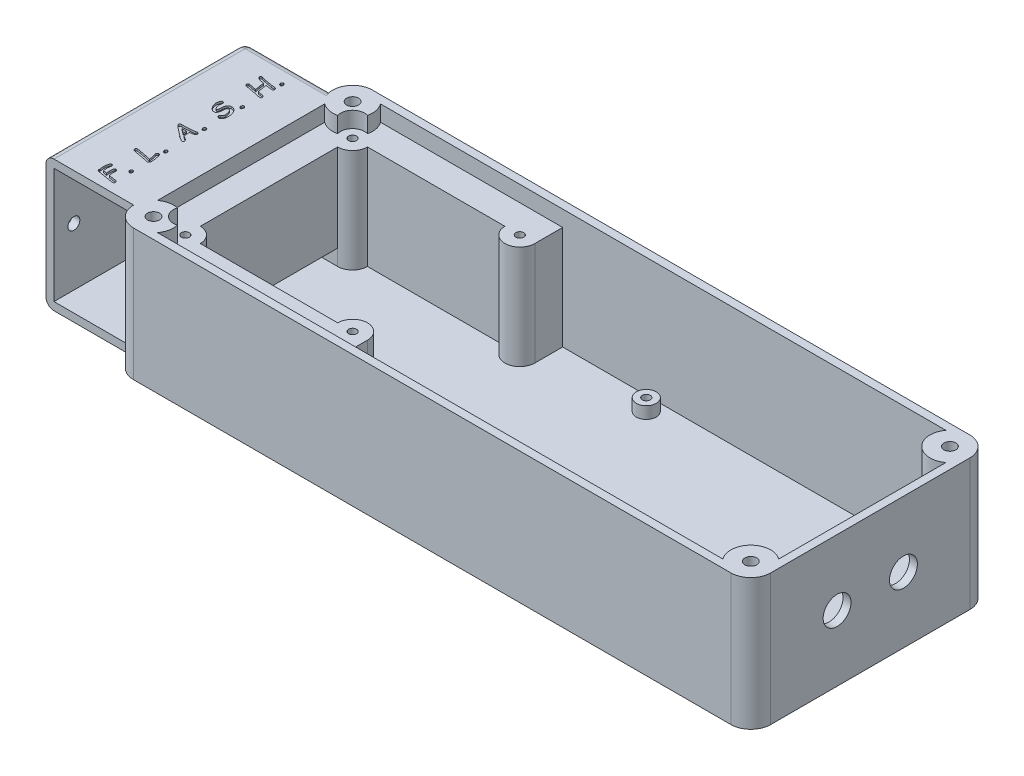
from build123d import *

# Parameters (mm, degrees)
BOSS_EXTRUDE1_DEPTH = 3
BOSS_EXTRUDE2_DEPTH = 30
SKETCH3_R           = 1
BOSS_EXTRUDE3_DEPTH = 26
SKETCH4_R           = 2.5
SKETCH4_R_2         = 1
BOSS_EXTRUDE4_DEPTH = 3
BOSS_EXTRUDE5_DEPTH = 20
SKETCH7_W           = 50
SKETCH7_H           = 33
BOSS_EXTRUDE6_DEPTH = 2
FILLET1_R           = 2
SKETCH8_W           = 34.5
SKETCH8_H           = 4
CUT_EXTRUDE1_DEPTH  = 9
CUT_EXTRUDE2_REACH  = 196.456
SKETCH9_R           = 3.5
SKETCH10_R          = 5
SKETCH10_R_2        = 1.5
BOSS_EXTRUDE7_DEPTH = 30
CUT_EXTRUDE3_DEPTH  = 0.5
CUT_EXTRUDE4_REACH  = 196.456
SKETCH12_R          = 1.5


with BuildPart() as part:
    # Sketch1 → Boss-Extrude1 (new body)
    with BuildSketch(Plane(origin=(0, 0, 0), x_dir=(1, 0, 0), z_dir=(0, 1, 0))):
        with BuildLine():
            Line((5, 0), (155, 0))
            ThreePointArc((155, 0), (158.535533906, -1.464466094), (160, -5))
            Line((160, -5), (160, -55))
            ThreePointArc((160, -55), (158.535533906, -58.535533906), (155, -60))
            Line((155, -60), (5, -60))
            ThreePointArc((5, -60), (1.464466094, -58.535533906), (0, -55))
            Line((0, -55), (0, -5))
            ThreePointArc((0, -5), (1.464466094, -1.464466094), (5, 0))
        make_face()
    extrude(amount=BOSS_EXTRUDE1_DEPTH)

    # Sketch2 → Boss-Extrude2 (add)
    with BuildSketch(Plane(origin=(0, 3, 0), x_dir=(1, 0, 0), z_dir=(0, 1, 0))):
        with BuildLine():
            Line((155, 0), (5, 0))
            ThreePointArc((5, 0), (1.464466094, -1.464466094), (0, -5))
            Line((0, -5), (0, -55))
            ThreePointArc((0, -55), (1.464466094, -58.535533906), (5, -60))
            Line((5, -60), (155, -60))
            ThreePointArc((155, -60), (158.535533906, -58.535533906), (160, -55))
            Line((160, -55), (160, -5))
            ThreePointArc((160, -5), (158.535533906, -1.464466094), (155, 0))
        make_face()
        with BuildLine():
            Line((7, -2), (153, -2))
            ThreePointArc((153, -2), (156.535533906, -3.464466094), (158, -7))
            Line((158, -7), (158, -53))
            ThreePointArc((158, -53), (156.535533906, -56.535533906), (153, -58))
            Line((153, -58), (7, -58))
            ThreePointArc((7, -58), (3.464466094, -56.535533906), (2, -53))
            Line((2, -53), (2, -7))
            ThreePointArc((2, -7), (3.464466094, -3.464466094), (7, -2))
        make_face(mode=Mode.SUBTRACT)
    extrude(amount=BOSS_EXTRUDE2_DEPTH)

    # Sketch3 → Boss-Extrude3 (add)
    with BuildSketch(Plane(origin=(0, 3, 0), x_dir=(1, 0, 0), z_dir=(0, 1, 0))):
        with BuildLine():
            Line((12.75, -9), (47.25, -9))
            ThreePointArc((47.25, -9), (48.348349571, -11.651650429), (51, -12.75))
            ThreePointArc((51, -12.75), (53.651650429, -11.651650429), (54.75, -9))
            Line((54.75, -9), (54.75, -2))
            Line((54.75, -2), (7, -2))
            ThreePointArc((7, -2), (3.464466094, -3.464466094), (2, -7))
            Line((2, -7), (2, -53))
            ThreePointArc((2, -53), (3.464466094, -56.535533906), (7, -58))
            Line((7, -58), (54.75, -58))
            Line((54.75, -58), (54.75, -51))
            ThreePointArc((54.75, -51), (53.651650429, -48.348349571), (51, -47.25))
            ThreePointArc((51, -47.25), (48.348349571, -48.348349571), (47.25, -51))
            Line((47.25, -51), (12.75, -51))
            ThreePointArc((12.75, -51), (11.651650429, -48.348349571), (9, -47.25))
            Line((9, -47.25), (9, -12.75))
            ThreePointArc((9, -12.75), (11.651650429, -11.651650429), (12.75, -9))
        make_face()
        with Locations(Location((9, -9, 0), (0, 0, 270))):
            Circle(SKETCH3_R, mode=Mode.SUBTRACT)
        with Locations(Location((51, -9, 0), (0, 0, 270))):
            Circle(SKETCH3_R, mode=Mode.SUBTRACT)
        with Locations(Location((51, -51, 0), (0, 0, 270))):
            Circle(SKETCH3_R, mode=Mode.SUBTRACT)
        with Locations(Location((9, -51, 0), (0, 0, 270))):
            Circle(SKETCH3_R, mode=Mode.SUBTRACT)
    extrude(amount=BOSS_EXTRUDE3_DEPTH)

    # Sketch4 → Boss-Extrude4 (add)
    # profile 1 of 4: a face of its own
    with BuildSketch(Plane(origin=(0, 3, 0), x_dir=(1, 0, 0), z_dir=(0, 1, 0))):
        with Locations(Location((79.25, -5.5, 0), (0, 0, 90))):
            Circle(SKETCH4_R)
        with Locations(Location((79.25, -5.5, 0), (0, 0, 270))):
            Circle(SKETCH4_R_2, mode=Mode.SUBTRACT)
    # profile 2 of 4: a face of its own
    with BuildSketch(Plane(origin=(0, 3, 0), x_dir=(1, 0, 0), z_dir=(0, 1, 0))):
        with Locations(Location((79.25, -54.5, 0), (0, 0, 90))):
            Circle(SKETCH4_R)
        with Locations(Location((79.25, -54.5, 0), (0, 0, 270))):
            Circle(SKETCH4_R_2, mode=Mode.SUBTRACT)
    # profile 3 of 4: a face of its own
    with BuildSketch(Plane(origin=(0, 3, 0), x_dir=(1, 0, 0), z_dir=(0, 1, 0))):
        with Locations(Location((133.75, -49, 0), (0, 0, 90))):
            Circle(SKETCH4_R)
        with Locations(Location((133.75, -49, 0), (0, 0, 270))):
            Circle(SKETCH4_R_2, mode=Mode.SUBTRACT)
    # profile 4 of 4: a face of its own
    with BuildSketch(Plane(origin=(0, 3, 0), x_dir=(1, 0, 0), z_dir=(0, 1, 0))):
        with Locations(Location((133.75, -21, 0), (0, 0, 90))):
            Circle(SKETCH4_R)
        with Locations(Location((133.75, -21, 0), (0, 0, 270))):
            Circle(SKETCH4_R_2, mode=Mode.SUBTRACT)
    extrude(amount=BOSS_EXTRUDE4_DEPTH)

    # Sketch5 → Boss-Extrude5 (add)
    with BuildSketch(Plane.ZY):
        Polygon((55, 33), (55, 31), (7, 31), (7, 2), (55, 2), (55, 0), (5, 0), (5, 33), align=None)
    extrude(amount=BOSS_EXTRUDE5_DEPTH)

    # Sketch7 → Boss-Extrude6 (add)
    with BuildSketch(Plane.ZY.offset(20)):
        with Locations((30, 16.5)):
            Rectangle(SKETCH7_W, SKETCH7_H)
    extrude(amount=BOSS_EXTRUDE6_DEPTH)

    # Fillet1
    fillet1_edges = [part.edges().sort_by_distance(p)[0] for p in [
        (-11, 33, 5),
        (-11, 0, 5),
        (-22, 16.5, 5),
        (-22, 0, 30),
        (-22, 33, 30),
    ]]
    fillet(fillet1_edges, radius=FILLET1_R)

    # Sketch8 → Cut-Extrude1 (cut)
    with BuildSketch(Plane(origin=(9, 0, 0), x_dir=(0, 0, -1), z_dir=(1, 0, 0))):
        with Locations((-30, 5)):
            Rectangle(SKETCH8_W, SKETCH8_H)
    extrude(amount=-CUT_EXTRUDE1_DEPTH, mode=Mode.SUBTRACT)

    # Sketch9 → Cut-Extrude2 (cut, up to next)
    with BuildSketch(Plane(origin=(160, 0, 0), x_dir=(0, 0, -1), z_dir=(1, 0, 0)), mode=Mode.PRIVATE) as cut_extrude2_sk1:
        with Locations((-21.666666667, 16.5)):
            Circle(SKETCH9_R)
    cut_extrude2_tool1 = extrude(cut_extrude2_sk1.sketch, amount=-CUT_EXTRUDE2_REACH, mode=Mode.PRIVATE) & part.part
    # Sketch9 → Cut-Extrude2 (cut, up to next)
    with BuildSketch(Plane(origin=(160, 0, 0), x_dir=(0, 0, -1), z_dir=(1, 0, 0)), mode=Mode.PRIVATE) as cut_extrude2_sk2:
        with Locations((-38.333333333, 16.5)):
            Circle(SKETCH9_R)
    cut_extrude2_tool2 = extrude(cut_extrude2_sk2.sketch, amount=-CUT_EXTRUDE2_REACH, mode=Mode.PRIVATE) & part.part
    add(cut_extrude2_tool1.solids().sort_by_distance((160, 16.5, 21.666667))[0], mode=Mode.SUBTRACT)
    add(cut_extrude2_tool2.solids().sort_by_distance((160, 16.5, 38.333333))[0], mode=Mode.SUBTRACT)

    # Sketch10 → Boss-Extrude7 (add)
    # profile 1 of 4: a face of its own
    with BuildSketch(Plane(origin=(0, 3, 0), x_dir=(1, 0, 0), z_dir=(0, 1, 0))):
        with Locations((155, -5)):
            Circle(SKETCH10_R)
        with Locations(Location((155, -5, 0), (0, 0, 270))):
            Circle(SKETCH10_R_2, mode=Mode.SUBTRACT)
    # profile 2 of 4: a face of its own
    with BuildSketch(Plane(origin=(0, 3, 0), x_dir=(1, 0, 0), z_dir=(0, 1, 0))):
        with Locations((155, -55)):
            Circle(SKETCH10_R)
        with Locations(Location((155, -55, 0), (0, 0, 270))):
            Circle(SKETCH10_R_2, mode=Mode.SUBTRACT)
    # profile 3 of 4: a face of its own
    with BuildSketch(Plane(origin=(0, 3, 0), x_dir=(1, 0, 0), z_dir=(0, 1, 0))):
        with BuildLine():
            ThreePointArc((9.870828693, -6.129171307), (1.464466094, -1.464466094), (6.129171307, -9.870828693))
            ThreePointArc((6.129171307, -9.870828693), (6.878679656, -6.878679656), (9.870828693, -6.129171307))
        make_face()
        with Locations(Location((5, -5, 0), (0, 0, 270))):
            Circle(SKETCH10_R_2, mode=Mode.SUBTRACT)
    # profile 4 of 4: a face of its own
    with BuildSketch(Plane(origin=(0, 3, 0), x_dir=(1, 0, 0), z_dir=(0, 1, 0))):
        with BuildLine():
            ThreePointArc((6.129171307, -50.129171307), (1.464466094, -58.535533906), (9.870828693, -53.870828693))
            ThreePointArc((9.870828693, -53.870828693), (6.878679656, -53.121320344), (6.129171307, -50.129171307))
        make_face()
        with Locations(Location((5, -55, 0), (0, 0, 270))):
            Circle(SKETCH10_R_2, mode=Mode.SUBTRACT)
    extrude(amount=BOSS_EXTRUDE7_DEPTH)

    # Sketch11 → Cut-Extrude3 (cut)
    # profile 1 of 10: a face of its own
    with BuildSketch(Plane(origin=(0, 33, 0), x_dir=(1, 0, 0), z_dir=(0, 1, 0))):
        with BuildLine():
            add(Edge.make_bspline(
                [(-7.572070313, -10.621972656), (-7.600806562, -10.619995989), (-7.658970131, -10.615995119), (-7.742585597, -10.580677182), (-7.821140659, -10.525528326), (-7.892194562, -10.451150341), (-7.95363411, -10.365017402), (-7.998031542, -10.269917838), (-8.027063241, -10.17045346), (-8.030174539, -10.101858655), (-8.031738281, -10.067382813)],
                knots=[0, 0, 0, 0, 0.870726891, 1.76239366, 2.716285421, 3.774654455, 4.87450341, 5.918603683, 6.95388735, 8, 8, 8, 8], degree=3))
            add(Edge.make_bspline(
                [(-8.031738281, -10.067382813), (-8.030777497, -10.036787302), (-8.028935831, -9.978140712), (-8.008805107, -9.894968702), (-7.977642726, -9.82083708), (-7.932948832, -9.7579503), (-7.879941561, -9.706859631), (-7.819405358, -9.669734183), (-7.752734035, -9.646386999), (-7.705855585, -9.644059045), (-7.681933594, -9.642871094)],
                knots=[0, 0, 0, 0, 1.192390478, 2.285617512, 3.320552277, 4.313938436, 5.276821529, 6.175379738, 7.068899467, 8, 8, 8, 8], degree=3))
            add(Edge.make_bspline(
                [(-7.681933594, -9.642871094), (-7.651755013, -9.644837385), (-7.59172435, -9.648748695), (-7.505353903, -9.682830508), (-7.425963891, -9.737986576), (-7.355996363, -9.812833103), (-7.294559155, -9.89839364), (-7.251375911, -9.994424337), (-7.223569614, -10.095707147), (-7.22036789, -10.165638814), (-7.21875, -10.200976563)],
                knots=[0, 0, 0, 0, 0.904529017, 1.799272064, 2.749551301, 3.789732453, 4.86478719, 5.901270539, 6.939473697, 8, 8, 8, 8], degree=3))
            add(Edge.make_bspline(
                [(-7.21875, -10.200976563), (-7.220187759, -10.229197872), (-7.222979334, -10.283992777), (-7.242283905, -10.363511708), (-7.277775481, -10.435254108), (-7.323490176, -10.499759684), (-7.378266761, -10.552804263), (-7.438138916, -10.593386538), (-7.503869497, -10.617189974), (-7.549333554, -10.620378208), (-7.572070313, -10.621972656)],
                knots=[0, 0, 0, 0, 1.115563064, 2.165993459, 3.207062572, 4.261125149, 5.276633054, 6.204865414, 7.102245947, 8, 8, 8, 8], degree=3))
        make_face()
    # profile 2 of 10: a face of its own
    with BuildSketch(Plane(origin=(0, 33, 0), x_dir=(1, 0, 0), z_dir=(0, 1, 0))):
        with BuildLine():
            add(Edge.make_bspline(
                [(-9.365917969, -12.330566406), (-9.364497364, -12.354592007), (-9.361464023, -12.405892575), (-9.355635781, -12.488021252), (-9.345338849, -12.579910532), (-9.333882646, -12.682147913), (-9.32128235, -12.794510025), (-9.303721006, -12.916492134), (-9.286134221, -13.048541654), (-9.262913741, -13.190021612), (-9.241203192, -13.342384059), (-9.214045166, -13.504181351), (-9.186529761, -13.676353846), (-9.154202456, -13.858073122), (-9.121087673, -14.050015268), (-9.086100145, -14.252299457), (-9.04715415, -14.46396268), (-9.020779389, -14.608687629), (-9.007324219, -14.682519531)],
                knots=[0, 0, 0, 0, 0.485350309, 1.036342316, 1.660070137, 2.349680616, 3.111070915, 3.939909977, 4.834742519, 5.797318768, 6.830869476, 7.938114566, 9.105570656, 10.346869518, 11.660039808, 13.033440574, 14.486600069, 16, 16, 16, 16], degree=3))
            add(Edge.make_bspline(
                [(-9.007324219, -14.682519531), (-8.985928745, -14.686280467), (-8.941047086, -14.694169848), (-8.870485822, -14.707596932), (-8.793298166, -14.722161414), (-8.709930327, -14.740096283), (-8.61999239, -14.759444057), (-8.523601059, -14.780517983), (-8.420645624, -14.803128902), (-8.35017195, -14.819819664), (-8.313867188, -14.828417969)],
                knots=[0, 0, 0, 0, 0.735613483, 1.54310925, 2.432282106, 3.39541894, 4.430612042, 5.547574119, 6.736624149, 8, 8, 8, 8], degree=3))
            add(Edge.make_bspline(
                [(-8.313867188, -14.828417969), (-8.27490487, -14.836633905), (-8.199903505, -14.852449351), (-8.091745845, -14.87504259), (-7.99243622, -14.897032659), (-7.900663923, -14.913662376), (-7.817973606, -14.930897514), (-7.743456136, -14.944717136), (-7.67766616, -14.957457414), (-7.636246929, -14.964155565), (-7.616894531, -14.967285156)],
                knots=[0, 0, 0, 0, 1.34460385, 2.588324615, 3.731163278, 4.778881834, 5.737323996, 6.58327211, 7.338059151, 8, 8, 8, 8], degree=3))
            add(Edge.make_bspline(
                [(-7.616894531, -14.967285156), (-7.589363965, -14.97271178), (-7.535391455, -14.983350447), (-7.459096138, -15.017040245), (-7.391287296, -15.066422416), (-7.331304439, -15.127546212), (-7.281681468, -15.196950945), (-7.244751409, -15.27155799), (-7.222830047, -15.350134304), (-7.220110696, -15.403677214), (-7.21875, -15.43046875)],
                knots=[0, 0, 0, 0, 1.013249324, 1.986432401, 2.989703123, 4.031830092, 5.073309642, 6.064348679, 7.031448397, 8, 8, 8, 8], degree=3))
            add(Edge.make_bspline(
                [(-7.21875, -15.43046875), (-7.21980675, -15.454635791), (-7.221851218, -15.501391142), (-7.241215534, -15.567583644), (-7.271200018, -15.627530857), (-7.314755944, -15.677690141), (-7.365575143, -15.719227027), (-7.422973959, -15.750084797), (-7.486648923, -15.767930228), (-7.530944456, -15.770281223), (-7.553613281, -15.771484375)],
                knots=[0, 0, 0, 0, 1.083594083, 2.096401497, 3.073932841, 4.07364677, 5.056572285, 6.010770162, 6.981985316, 8, 8, 8, 8], degree=3))
            add(Edge.make_bspline(
                [(-7.553613281, -15.771484375), (-7.568581653, -15.770873368), (-7.60575944, -15.769355776), (-7.671758691, -15.757703589), (-7.759611222, -15.743777053), (-7.86857683, -15.720556046), (-7.999675308, -15.69376438), (-8.152417542, -15.660456544), (-8.326450045, -15.619369545), (-8.449795746, -15.590684078), (-8.515136719, -15.575488281)],
                knots=[0, 0, 0, 0, 0.365775055, 0.908496073, 1.634736488, 2.540401088, 3.63003813, 4.905185618, 6.360557522, 8, 8, 8, 8], degree=3))
            add(Edge.make_bspline(
                [(-8.515136719, -15.575488281), (-8.547364453, -15.567878314), (-8.616179152, -15.55162903), (-8.72634935, -15.525450222), (-8.850920496, -15.50009069), (-8.989014887, -15.470491969), (-9.140853649, -15.440104757), (-9.306607682, -15.407234425), (-9.48638217, -15.373624944), (-9.679769589, -15.335881032), (-9.887186815, -15.299055366), (-10.108088552, -15.257607353), (-10.343332773, -15.217294259), (-10.592203826, -15.172780344), (-10.854740521, -15.127279045), (-11.131372421, -15.079930489), (-11.421542595, -15.029466657), (-11.619997961, -14.9964551), (-11.721386719, -14.979589844)],
                knots=[0, 0, 0, 0, 0.487332004, 1.04058215, 1.666327894, 2.358023282, 3.119022813, 3.945131937, 4.844840007, 5.810498492, 6.844762184, 7.944969867, 9.1180837, 10.357132996, 11.66561901, 13.039300903, 14.487409998, 16, 16, 16, 16], degree=3))
            add(Edge.make_bspline(
                [(-11.721386719, -14.979589844), (-11.74836198, -14.974523456), (-11.801585172, -14.964527286), (-11.876040495, -14.930444984), (-11.943502692, -14.883272089), (-12.002711468, -14.823577061), (-12.051813863, -14.755241526), (-12.086453587, -14.679640729), (-12.108653283, -14.599696017), (-12.111207862, -14.54438385), (-12.1125, -14.51640625)],
                knots=[0, 0, 0, 0, 0.994830868, 1.962838208, 2.949825045, 3.974214553, 5.005723903, 5.992250767, 6.984454788, 8, 8, 8, 8], degree=3))
            add(Edge.make_bspline(
                [(-12.1125, -14.51640625), (-12.111223989, -14.492591263), (-12.108748896, -14.446397081), (-12.092278583, -14.379988606), (-12.062199633, -14.32102055), (-12.022653017, -14.268856442), (-11.974009797, -14.225571935), (-11.91688285, -14.195383238), (-11.85418376, -14.175912592), (-11.810012347, -14.173826385), (-11.787304688, -14.172753906)],
                knots=[0, 0, 0, 0, 1.080254188, 2.095380478, 3.075827588, 4.061751347, 5.050446695, 6.0016474, 6.972686053, 8, 8, 8, 8], degree=3))
            add(Edge.make_bspline(
                [(-11.787304688, -14.172753906), (-11.775573015, -14.173178302), (-11.746728354, -14.174221764), (-11.695475951, -14.181339197), (-11.62779313, -14.191820704), (-11.543808564, -14.207127618), (-11.443233532, -14.225403295), (-11.326372259, -14.24846749), (-11.193043639, -14.275592644), (-11.098810454, -14.295715812), (-11.049023438, -14.306347656)],
                knots=[0, 0, 0, 0, 0.37507502, 0.922196926, 1.652020016, 2.565064674, 3.650657883, 4.919803416, 6.372613655, 8, 8, 8, 8], degree=3))
            Line((-11.049023438, -14.306347656), (-10.658789063, -14.377539063))
            add(Edge.make_bspline(
                [(-10.658789063, -14.377539063), (-10.602220879, -14.387360774), (-10.495435935, -14.405901424), (-10.344593996, -14.434265585), (-10.212071649, -14.460205822), (-10.12995306, -14.478188991), (-10.091894531, -14.486523438)],
                knots=[0, 0, 0, 0, 1.193363047, 2.252736389, 3.190216443, 4, 4, 4, 4], degree=3))
            add(Edge.make_bspline(
                [(-10.091894531, -14.486523438), (-10.039901615, -14.500394404), (-9.940257716, -14.52697797), (-9.838900162, -14.545987517), (-9.790429688, -14.555078125)],
                knots=[0, 0, 0, 0, 1.04357451, 2, 2, 2, 2], degree=3))
            Line((-9.790429688, -14.555078125), (-10.01015625, -13.374707031))
            add(Edge.make_bspline(
                [(-10.01015625, -13.374707031), (-10.027500575, -13.274907675), (-10.061801823, -13.077538077), (-10.1014535, -12.782985666), (-10.128926855, -12.49385207), (-10.138848949, -12.30277941), (-10.14375, -12.208398438)],
                knots=[0, 0, 0, 0, 1.034536652, 2.045965941, 3.034798409, 4, 4, 4, 4], degree=3))
            add(Edge.make_bspline(
                [(-10.14375, -12.208398438), (-10.16394024, -12.203598742), (-10.210908397, -12.192433307), (-10.292329119, -12.176371829), (-10.393970523, -12.155205832), (-10.516206391, -12.129186645), (-10.659732834, -12.101790066), (-10.82366612, -12.068912611), (-11.008266817, -12.033027032), (-11.138082586, -12.007990145), (-11.206347656, -11.994824219)],
                knots=[0, 0, 0, 0, 0.459481678, 1.06888316, 1.837316034, 2.758429123, 3.835999413, 5.072592057, 6.460589882, 8, 8, 8, 8], degree=3))
            add(Edge.make_bspline(
                [(-11.206347656, -11.994824219), (-11.251486827, -11.985424412), (-11.345330678, -11.965882313), (-11.486439514, -11.911778556), (-11.632548632, -11.837001008), (-11.755946145, -11.761950488), (-11.849526684, -11.692634328), (-11.913733903, -11.642591988), (-11.966426203, -11.590868509), (-12.01111554, -11.541477647), (-12.04504446, -11.491308775), (-12.070167259, -11.44258196), (-12.085185935, -11.393631891), (-12.087589394, -11.361224868), (-12.088769531, -11.3453125)],
                knots=[0, 0, 0, 0, 1.438266724, 2.990141036, 4.700705817, 6.562071707, 7.491832014, 8.337849346, 9.101467746, 9.795281904, 10.414551478, 10.987466272, 11.502829696, 12, 12, 12, 12], degree=3))
            add(Edge.make_bspline(
                [(-12.088769531, -11.3453125), (-12.087596453, -11.321462452), (-12.085303408, -11.274842192), (-12.067003748, -11.20781526), (-12.037745495, -11.145790674), (-11.996257669, -11.091145192), (-11.947459994, -11.044580925), (-11.891167722, -11.011334646), (-11.830463195, -10.989649578), (-11.787780364, -10.987702626), (-11.766210938, -10.98671875)],
                knots=[0, 0, 0, 0, 1.0677216, 2.087100932, 3.091566911, 4.123808257, 5.145975439, 6.094178081, 7.036908172, 8, 8, 8, 8], degree=3))
            add(Edge.make_bspline(
                [(-11.766210938, -10.98671875), (-11.74043834, -10.988025778), (-11.688295348, -10.99067015), (-11.639643748, -11.009643066), (-11.615039063, -11.019238281)],
                knots=[0, 0, 0, 0, 0.988535437, 2, 2, 2, 2], degree=3))
            add(Edge.make_bspline(
                [(-11.615039063, -11.019238281), (-11.580662474, -11.03353773), (-11.509310937, -11.063217452), (-11.39447205, -11.098717775), (-11.270555337, -11.134001271), (-11.183631092, -11.152205466), (-11.138671875, -11.161621094)],
                knots=[0, 0, 0, 0, 0.896594701, 1.860958643, 2.893638677, 4, 4, 4, 4], degree=3))
            add(Edge.make_bspline(
                [(-11.138671875, -11.161621094), (-11.115185789, -11.166997733), (-11.064744257, -11.178545248), (-11.014975062, -11.192718777), (-10.988378906, -11.200292969)],
                knots=[0, 0, 0, 0, 0.931220167, 2, 2, 2, 2], degree=3))
            add(Edge.make_bspline(
                [(-10.988378906, -11.200292969), (-10.956755923, -11.207116713), (-10.900308288, -11.219297229), (-10.825887851, -11.234234325), (-10.771689934, -11.244301976), (-10.742293788, -11.248685527), (-10.730859375, -11.250390625)],
                knots=[0, 0, 0, 0, 1.479453001, 2.640852092, 3.471323273, 4, 4, 4, 4], degree=3))
            add(Edge.make_bspline(
                [(-10.730859375, -11.250390625), (-10.714458505, -11.253349725), (-10.676395831, -11.260217119), (-10.611156898, -11.271148224), (-10.530555103, -11.287758359), (-10.433992277, -11.305589043), (-10.321873135, -11.328020312), (-10.194080006, -11.353212123), (-10.050560517, -11.382395549), (-9.949802245, -11.403015672), (-9.896777344, -11.413867188)],
                knots=[0, 0, 0, 0, 0.470573601, 1.092093842, 1.867569782, 2.793950245, 3.864686625, 5.096028878, 6.471760405, 8, 8, 8, 8], degree=3))
            add(Edge.make_bspline(
                [(-9.896777344, -11.413867188), (-9.835267058, -11.426820999), (-9.716409101, -11.451851993), (-9.545051347, -11.486875387), (-9.3869131, -11.51801664), (-9.242453404, -11.544325057), (-9.110852335, -11.566303604), (-8.993131293, -11.584886713), (-8.888510291, -11.599206566), (-8.823354179, -11.606466666), (-8.792871094, -11.609863281)],
                knots=[0, 0, 0, 0, 1.345023653, 2.599024899, 3.74238076, 4.793682533, 5.740782971, 6.597242334, 7.343724173, 8, 8, 8, 8], degree=3))
            Line((-8.792871094, -11.609863281), (-7.852441406, -11.701269531))
            add(Edge.make_bspline(
                [(-7.852441406, -11.701269531), (-7.817611761, -11.705579013), (-7.750710793, -11.71385669), (-7.657167165, -11.746274422), (-7.575586058, -11.79386968), (-7.508985845, -11.857434753), (-7.45511336, -11.929396411), (-7.415596934, -12.008757424), (-7.392016338, -12.094857301), (-7.389024785, -12.154346518), (-7.3875, -12.184667969)],
                knots=[0, 0, 0, 0, 1.133253279, 2.1767589, 3.180074814, 4.166218678, 5.135257294, 6.07662488, 7.019662277, 8, 8, 8, 8], degree=3))
            add(Edge.make_bspline(
                [(-7.3875, -12.184667969), (-7.388639456, -12.210558301), (-7.390830783, -12.260348859), (-7.408903689, -12.331713788), (-7.439120836, -12.395853307), (-7.480304436, -12.451639202), (-7.529180864, -12.497947475), (-7.584668464, -12.530509692), (-7.64425288, -12.552793679), (-7.686125444, -12.554631625), (-7.707421875, -12.555566406)],
                knots=[0, 0, 0, 0, 1.139710839, 2.19181583, 3.219801284, 4.244945312, 5.231562698, 6.163713555, 7.066062728, 8, 8, 8, 8], degree=3))
            Line((-7.707421875, -12.555566406), (-8.794628906, -12.421972656))
            add(Edge.make_bspline(
                [(-8.794628906, -12.421972656), (-8.820428919, -12.419193667), (-8.869752773, -12.41388086), (-8.93999988, -12.403919523), (-9.003048141, -12.394569954), (-9.042494867, -12.387489862), (-9.0609375, -12.384179688)],
                knots=[0, 0, 0, 0, 1.157323206, 2.212543097, 3.16430554, 4, 4, 4, 4], degree=3))
            Line((-9.0609375, -12.384179688), (-9.223535156, -12.356933594))
            add(Edge.make_bspline(
                [(-9.223535156, -12.356933594), (-9.247616834, -12.353439155), (-9.295421162, -12.346502374), (-9.342536986, -12.335851732), (-9.365917969, -12.330566406)],
                knots=[0, 0, 0, 0, 1.007510363, 2, 2, 2, 2], degree=3))
        make_face()
    # profile 3 of 10: a face of its own
    with BuildSketch(Plane(origin=(0, 33, 0), x_dir=(1, 0, 0), z_dir=(0, 1, 0))):
        with BuildLine():
            add(Edge.make_bspline(
                [(-7.572070313, -20.578222656), (-7.600806562, -20.576245989), (-7.658970131, -20.572245119), (-7.742585597, -20.536927182), (-7.821140659, -20.481778326), (-7.892194562, -20.407400341), (-7.95363411, -20.321267402), (-7.998031542, -20.226167838), (-8.027063241, -20.12670346), (-8.030174539, -20.058108655), (-8.031738281, -20.023632813)],
                knots=[0, 0, 0, 0, 0.870726891, 1.76239366, 2.716285421, 3.774654455, 4.87450341, 5.918603683, 6.95388735, 8, 8, 8, 8], degree=3))
            add(Edge.make_bspline(
                [(-8.031738281, -20.023632813), (-8.030777497, -19.993037302), (-8.028935831, -19.934390712), (-8.008805107, -19.851218702), (-7.977642726, -19.77708708), (-7.932948832, -19.7142003), (-7.879941561, -19.663109631), (-7.819405358, -19.625984183), (-7.752734035, -19.602636999), (-7.705855585, -19.600309045), (-7.681933594, -19.599121094)],
                knots=[0, 0, 0, 0, 1.192390478, 2.285617512, 3.320552277, 4.313938436, 5.276821529, 6.175379738, 7.068899467, 8, 8, 8, 8], degree=3))
            add(Edge.make_bspline(
                [(-7.681933594, -19.599121094), (-7.651755013, -19.601087385), (-7.59172435, -19.604998695), (-7.505353903, -19.639080508), (-7.425963891, -19.694236576), (-7.355996363, -19.769083103), (-7.294559155, -19.85464364), (-7.251375911, -19.950674337), (-7.223569614, -20.051957147), (-7.22036789, -20.121888814), (-7.21875, -20.157226563)],
                knots=[0, 0, 0, 0, 0.904529017, 1.799272064, 2.749551301, 3.789732453, 4.86478719, 5.901270539, 6.939473697, 8, 8, 8, 8], degree=3))
            add(Edge.make_bspline(
                [(-7.21875, -20.157226563), (-7.220187759, -20.185447872), (-7.222979334, -20.240242777), (-7.242283905, -20.319761708), (-7.277775481, -20.391504108), (-7.323490176, -20.456009684), (-7.378266761, -20.509054263), (-7.438138916, -20.549636538), (-7.503869497, -20.573439974), (-7.549333554, -20.576628208), (-7.572070313, -20.578222656)],
                knots=[0, 0, 0, 0, 1.115563064, 2.165993459, 3.207062572, 4.261125149, 5.276633054, 6.204865414, 7.102245947, 8, 8, 8, 8], degree=3))
        make_face()
    # profile 4 of 10: a face of its own
    with BuildSketch(Plane(origin=(0, 33, 0), x_dir=(1, 0, 0), z_dir=(0, 1, 0))):
        with BuildLine():
            add(Edge.make_bspline(
                [(-8.200488281, -25.384082031), (-8.238736588, -25.382206368), (-8.312752849, -25.378576676), (-8.418832776, -25.351007007), (-8.513446895, -25.303597488), (-8.595417623, -25.239109427), (-8.66221148, -25.161419615), (-8.710320285, -25.07360556), (-8.741272416, -24.978011814), (-8.744590104, -24.911178083), (-8.746289063, -24.876953125)],
                knots=[0, 0, 0, 0, 1.103674389, 2.135776933, 3.138334457, 4.138497832, 5.128557016, 6.075122346, 7.014287332, 8, 8, 8, 8], degree=3))
            add(Edge.make_bspline(
                [(-8.746289063, -24.876953125), (-8.745385236, -24.856396158), (-8.743625077, -24.816362454), (-8.73166382, -24.758380187), (-8.709099229, -24.706009464), (-8.678876294, -24.658738126), (-8.640403849, -24.61657691), (-8.59269974, -24.580566345), (-8.53705278, -24.548443419), (-8.495485081, -24.532709277), (-8.473828125, -24.524511719)],
                knots=[0, 0, 0, 0, 1.028424595, 2.002807361, 2.941835938, 3.864600554, 4.798124275, 5.780081359, 6.843412479, 8, 8, 8, 8], degree=3))
            add(Edge.make_bspline(
                [(-8.473828125, -24.524511719), (-8.444476074, -24.51441771), (-8.386874412, -24.494608816), (-8.311642517, -24.441857494), (-8.247029119, -24.37616942), (-8.195866737, -24.293562523), (-8.155276826, -24.196967097), (-8.128439226, -24.084760481), (-8.110215533, -23.95821348), (-8.108897964, -23.868629915), (-8.108203125, -23.821386719)],
                knots=[0, 0, 0, 0, 0.868143274, 1.703679709, 2.553486109, 3.441686871, 4.415462445, 5.485464834, 6.673923302, 8, 8, 8, 8], degree=3))
            add(Edge.make_bspline(
                [(-8.108203125, -23.821386719), (-8.108875023, -23.780639182), (-8.110235482, -23.698133578), (-8.121619453, -23.573530332), (-8.137780012, -23.446067129), (-8.163091971, -23.316647468), (-8.193385514, -23.184128488), (-8.232601046, -23.050108998), (-8.277689961, -22.913200388), (-8.327740866, -22.776527731), (-8.383928269, -22.646975223), (-8.445996726, -22.531667307), (-8.513629307, -22.433876195), (-8.586838995, -22.353465326), (-8.665847443, -22.290487652), (-8.750707811, -22.245677892), (-8.840964122, -22.21794316), (-8.90312952, -22.214645664), (-8.934375, -22.212988281)],
                knots=[0, 0, 0, 0, 1.000163562, 2.025130972, 3.069819513, 4.153183978, 5.261030478, 6.406075669, 7.579700916, 8.799493589, 9.978176925, 11.04355729, 12.009301913, 12.889869731, 13.704269102, 14.476410694, 15.234215806, 16, 16, 16, 16], degree=3))
            add(Edge.make_bspline(
                [(-8.934375, -22.212988281), (-8.955512141, -22.213651185), (-8.995972945, -22.214920119), (-9.054101849, -22.224898803), (-9.107466083, -22.240535355), (-9.156216848, -22.263087327), (-9.198916429, -22.293966401), (-9.237109615, -22.330075265), (-9.270057611, -22.373031454), (-9.298108404, -22.423881232), (-9.320674311, -22.486018143), (-9.341991691, -22.56106232), (-9.358482496, -22.651503774), (-9.37349448, -22.756746431), (-9.385402058, -22.876990644), (-9.394890218, -23.012397614), (-9.401878633, -23.162735346), (-9.404235138, -23.267961687), (-9.40546875, -23.323046875)],
                knots=[0, 0, 0, 0, 0.748244787, 1.432293277, 2.082283056, 2.713533316, 3.323884902, 3.940379649, 4.569237507, 5.233401014, 5.988806201, 6.905273909, 7.993993313, 9.241307757, 10.670262424, 12.272282027, 14.048568018, 16, 16, 16, 16], degree=3))
            add(Edge.make_bspline(
                [(-9.40546875, -23.323046875), (-9.40702911, -23.367024551), (-9.410103184, -23.453665244), (-9.423087034, -23.581166426), (-9.439802127, -23.704610566), (-9.465097238, -23.823211201), (-9.494357936, -23.937605817), (-9.530884733, -24.047263958), (-9.572697207, -24.152538116), (-9.62063918, -24.25224577), (-9.673420693, -24.343591852), (-9.730054783, -24.424861892), (-9.793362331, -24.492231447), (-9.860137844, -24.54811849), (-9.931494403, -24.592434952), (-10.007650658, -24.623017485), (-10.088284228, -24.642533567), (-10.143636148, -24.644697042), (-10.171875, -24.645800781)],
                knots=[0, 0, 0, 0, 1.259728753, 2.481799424, 3.668191936, 4.824818158, 5.952078353, 7.047710392, 8.131945934, 9.193783801, 10.21249367, 11.150644379, 12.023147147, 12.851288212, 13.638296688, 14.417215551, 15.192511937, 16, 16, 16, 16], degree=3))
            add(Edge.make_bspline(
                [(-10.171875, -24.645800781), (-10.220091121, -24.64343783), (-10.317009047, -24.638688125), (-10.461473008, -24.604771105), (-10.603641923, -24.548114588), (-10.745510642, -24.471220533), (-10.884261134, -24.370126218), (-11.023169563, -24.249014716), (-11.159487531, -24.104674198), (-11.293788504, -23.943130703), (-11.418064216, -23.768441867), (-11.52865869, -23.587764089), (-11.622580249, -23.403782305), (-11.697839869, -23.215776239), (-11.758487811, -23.025666152), (-11.800742185, -22.832085275), (-11.825796027, -22.635232121), (-11.8294254, -22.502805508), (-11.83125, -22.436230469)],
                knots=[0, 0, 0, 0, 0.771536915, 1.550845555, 2.361649125, 3.21576911, 4.126758592, 5.103967915, 6.162083023, 7.301169292, 8.464575671, 9.590611865, 10.689633134, 11.766905863, 12.828911209, 13.880353734, 14.934386899, 16, 16, 16, 16], degree=3))
            add(Edge.make_bspline(
                [(-11.83125, -22.436230469), (-11.829512336, -22.38250639), (-11.825844933, -22.269119776), (-11.794795529, -22.09181199), (-11.749217271, -21.898593487), (-11.69758914, -21.731048107), (-11.649122415, -21.598727804), (-11.61106405, -21.510127147), (-11.570134606, -21.435787696), (-11.529695512, -21.373535845), (-11.486562553, -21.324784367), (-11.440933012, -21.29030578), (-11.393344962, -21.268285525), (-11.360360526, -21.265246136), (-11.344335938, -21.263769531)],
                knots=[0, 0, 0, 0, 1.444243323, 3.04812782, 4.829559939, 6.78377487, 7.758671341, 8.61960807, 9.374307208, 10.038732397, 10.613345018, 11.114533515, 11.56982025, 12, 12, 12, 12], degree=3))
            add(Edge.make_bspline(
                [(-11.344335938, -21.263769531), (-11.321257439, -21.265612209), (-11.272829328, -21.269478901), (-11.201100146, -21.298255694), (-11.127813935, -21.342356302), (-11.056682598, -21.402748196), (-10.990943712, -21.473625567), (-10.943499501, -21.556568612), (-10.913713887, -21.646733936), (-10.910195174, -21.709728198), (-10.908398438, -21.741894531)],
                knots=[0, 0, 0, 0, 0.783234486, 1.643545694, 2.594968369, 3.684023873, 4.805613056, 5.863104383, 6.908851469, 8, 8, 8, 8], degree=3))
            add(Edge.make_bspline(
                [(-10.908398438, -21.741894531), (-10.909053329, -21.769474376), (-10.910473163, -21.829268665), (-10.92460261, -21.925335398), (-10.943443949, -22.035402141), (-10.961299088, -22.112874365), (-10.970800781, -22.154101563)],
                knots=[0, 0, 0, 0, 0.791846382, 1.716757005, 2.784961805, 4, 4, 4, 4], degree=3))
            add(Edge.make_bspline(
                [(-10.970800781, -22.154101563), (-10.980050812, -22.192973339), (-10.997699607, -22.26713958), (-11.015733555, -22.37462195), (-11.028438243, -22.472255103), (-11.029883579, -22.534340545), (-11.030566406, -22.563671875)],
                knots=[0, 0, 0, 0, 1.155499204, 2.204659576, 3.151818502, 4, 4, 4, 4], degree=3))
            add(Edge.make_bspline(
                [(-11.030566406, -22.563671875), (-11.028100142, -22.628581174), (-11.023119597, -22.759663498), (-10.985104555, -22.956045192), (-10.925141203, -23.152874949), (-10.856302506, -23.313093633), (-10.793449158, -23.435140095), (-10.743530821, -23.514942633), (-10.693161443, -23.5830059), (-10.641533636, -23.63913241), (-10.587787526, -23.682533903), (-10.533298714, -23.714551677), (-10.476999557, -23.734195325), (-10.438619369, -23.736671646), (-10.419726563, -23.737890625)],
                knots=[0, 0, 0, 0, 1.65121316, 3.334573958, 5.072986933, 6.88041039, 7.764262, 8.564936225, 9.273313794, 9.916918678, 10.50034747, 11.024754193, 11.519931222, 12, 12, 12, 12], degree=3))
            add(Edge.make_bspline(
                [(-10.419726563, -23.737890625), (-10.404040313, -23.736678593), (-10.373096284, -23.734287636), (-10.328714479, -23.715699813), (-10.290715134, -23.683110271), (-10.256025359, -23.64045408), (-10.22720943, -23.584887168), (-10.202253817, -23.51816138), (-10.181160386, -23.439254968), (-10.171656543, -23.382329015), (-10.166601563, -23.352050781)],
                knots=[0, 0, 0, 0, 0.749837301, 1.479192817, 2.256849413, 3.124313788, 4.097079975, 5.238029668, 6.530940987, 8, 8, 8, 8], degree=3))
            Line((-10.166601563, -23.352050781), (-10.134082031, -22.663867188))
            add(Edge.make_bspline(
                [(-10.134082031, -22.663867188), (-10.130124651, -22.598093804), (-10.122415202, -22.469959389), (-10.089173246, -22.284739353), (-10.045958985, -22.110710681), (-9.984840022, -21.950603904), (-9.9115991, -21.805292279), (-9.822510763, -21.679126134), (-9.722175455, -21.570792089), (-9.606793573, -21.483932547), (-9.480045694, -21.415424643), (-9.341459006, -21.367285791), (-9.191710058, -21.33734316), (-9.088037338, -21.334031921), (-9.034570313, -21.332324219)],
                knots=[0, 0, 0, 0, 1.2230772, 2.382700613, 3.490244123, 4.549599871, 5.559789242, 6.505052217, 7.409854381, 8.291575961, 9.175528837, 10.075801711, 11.007635202, 12, 12, 12, 12], degree=3))
            add(Edge.make_bspline(
                [(-9.034570313, -21.332324219), (-9.00086716, -21.333160046), (-8.934229408, -21.334812639), (-8.835726858, -21.343098319), (-8.740508281, -21.359638648), (-8.647731389, -21.380135512), (-8.558181706, -21.408410622), (-8.47183781, -21.443132159), (-8.387666672, -21.482416568), (-8.307031861, -21.529184615), (-8.229419668, -21.581988649), (-8.155367231, -21.641351666), (-8.084031167, -21.706535505), (-8.015464747, -21.777974745), (-7.949394917, -21.855209679), (-7.887124451, -21.939246432), (-7.827108405, -22.02873618), (-7.752492643, -22.157411806), (-7.666166002, -22.325582159), (-7.576064466, -22.53639418), (-7.501002914, -22.7557627), (-7.437694678, -22.982971669), (-7.391464798, -23.219143094), (-7.355479157, -23.462751513), (-7.335472792, -23.714994965), (-7.332672303, -23.885807091), (-7.33125, -23.972558594)],
                knots=[0, 0, 0, 0, 0.695041069, 1.374232687, 2.035570632, 2.686146258, 3.331852805, 3.968941772, 4.603879617, 5.245192298, 5.888521379, 6.537524885, 7.200213035, 7.879431511, 8.577823961, 9.294190647, 10.034649053, 10.7981291, 12.359536771, 13.929112848, 15.52029692, 17.136596086, 18.78789852, 20.478383691, 22.21145305, 24, 24, 24, 24], degree=3))
            add(Edge.make_bspline(
                [(-7.33125, -23.972558594), (-7.332213686, -24.027360406), (-7.334086515, -24.133862427), (-7.345098024, -24.288893862), (-7.36519077, -24.43392578), (-7.393448211, -24.569583701), (-7.428967669, -24.695806109), (-7.472730158, -24.812885319), (-7.525834053, -24.91936251), (-7.585267202, -25.016405324), (-7.651231571, -25.101920054), (-7.719772696, -25.177527198), (-7.791790326, -25.241254102), (-7.867555616, -25.292883311), (-7.946142787, -25.333896374), (-8.028290748, -25.363205896), (-8.113665797, -25.380146483), (-8.171412199, -25.382764051), (-8.200488281, -25.384082031)],
                knots=[0, 0, 0, 0, 1.433132316, 2.785154019, 4.061452603, 5.25895914, 6.40599829, 7.487376868, 8.522075362, 9.512815082, 10.45823596, 11.342052669, 12.178057734, 12.966403917, 13.733927021, 14.489931521, 15.239660399, 16, 16, 16, 16], degree=3))
        make_face()
    # profile 5 of 10: a face of its own
    with BuildSketch(Plane(origin=(0, 33, 0), x_dir=(1, 0, 0), z_dir=(0, 1, 0))):
        with BuildLine():
            add(Edge.make_bspline(
                [(-7.572070313, -30.084472656), (-7.600806562, -30.082495989), (-7.658970131, -30.078495119), (-7.742585597, -30.043177182), (-7.821140659, -29.988028326), (-7.892194562, -29.913650341), (-7.95363411, -29.827517402), (-7.998031542, -29.732417838), (-8.027063241, -29.63295346), (-8.030174539, -29.564358655), (-8.031738281, -29.529882813)],
                knots=[0, 0, 0, 0, 0.870726891, 1.76239366, 2.716285421, 3.774654455, 4.87450341, 5.918603683, 6.95388735, 8, 8, 8, 8], degree=3))
            add(Edge.make_bspline(
                [(-8.031738281, -29.529882813), (-8.030777497, -29.499287302), (-8.028935831, -29.440640712), (-8.008805107, -29.357468702), (-7.977642726, -29.28333708), (-7.932948832, -29.2204503), (-7.879941561, -29.169359631), (-7.819405358, -29.132234183), (-7.752734035, -29.108886999), (-7.705855585, -29.106559045), (-7.681933594, -29.105371094)],
                knots=[0, 0, 0, 0, 1.192390478, 2.285617512, 3.320552277, 4.313938436, 5.276821529, 6.175379738, 7.068899467, 8, 8, 8, 8], degree=3))
            add(Edge.make_bspline(
                [(-7.681933594, -29.105371094), (-7.651755013, -29.107337385), (-7.59172435, -29.111248695), (-7.505353903, -29.145330508), (-7.425963891, -29.200486576), (-7.355996363, -29.275333103), (-7.294559155, -29.36089364), (-7.251375911, -29.456924337), (-7.223569614, -29.558207147), (-7.22036789, -29.628138814), (-7.21875, -29.663476563)],
                knots=[0, 0, 0, 0, 0.904529017, 1.799272064, 2.749551301, 3.789732453, 4.86478719, 5.901270539, 6.939473697, 8, 8, 8, 8], degree=3))
            add(Edge.make_bspline(
                [(-7.21875, -29.663476563), (-7.220187759, -29.691697872), (-7.222979334, -29.746492777), (-7.242283905, -29.826011708), (-7.277775481, -29.897754108), (-7.323490176, -29.962259684), (-7.378266761, -30.015304263), (-7.438138916, -30.055886538), (-7.503869497, -30.079689974), (-7.549333554, -30.082878208), (-7.572070313, -30.084472656)],
                knots=[0, 0, 0, 0, 1.115563064, 2.165993459, 3.207062572, 4.261125149, 5.276633054, 6.204865414, 7.102245947, 8, 8, 8, 8], degree=3))
        make_face()
    # profile 6 of 10: a face of its own
    with BuildSketch(Plane(origin=(0, 33, 0), x_dir=(1, 0, 0), z_dir=(0, 1, 0))):
        with BuildLine():
            add(Edge.make_bspline(
                [(-8.790234375, -32.193847656), (-8.787453664, -32.214045784), (-8.781499836, -32.257292336), (-8.77514065, -32.326872405), (-8.76718153, -32.40479294), (-8.757853517, -32.491408195), (-8.750388067, -32.586990466), (-8.742705768, -32.691325254), (-8.733523042, -32.804360031), (-8.728046017, -32.8826113), (-8.725195313, -32.923339844)],
                knots=[0, 0, 0, 0, 0.667948484, 1.430155814, 2.288832852, 3.2344296, 4.284292224, 5.429847544, 6.662276458, 8, 8, 8, 8], degree=3))
            add(Edge.make_bspline(
                [(-8.725195313, -32.923339844), (-8.722576074, -32.96347739), (-8.717527928, -33.040835816), (-8.709938608, -33.152801222), (-8.700815024, -33.256465861), (-8.692409521, -33.352041861), (-8.682861708, -33.439092411), (-8.67206107, -33.517548147), (-8.661731407, -33.587904456), (-8.654087886, -33.632044785), (-8.650488281, -33.652832031)],
                knots=[0, 0, 0, 0, 1.315701827, 2.535795874, 3.670644019, 4.719578435, 5.674134435, 6.534739676, 7.309956958, 8, 8, 8, 8], degree=3))
            add(Edge.make_bspline(
                [(-8.650488281, -33.652832031), (-8.583143121, -33.695663248), (-8.455448998, -33.776876133), (-8.273973546, -33.891044936), (-8.1162802, -33.995407971), (-7.979203815, -34.085293854), (-7.865624598, -34.164795555), (-7.77237667, -34.229674234), (-7.703155916, -34.284701288), (-7.63845888, -34.337818255), (-7.581708195, -34.403076478), (-7.533472001, -34.487323368), (-7.505674627, -34.581011589), (-7.501919794, -34.646110414), (-7.5, -34.679394531)],
                knots=[0, 0, 0, 0, 1.795753213, 3.40495342, 4.823687191, 6.050417814, 7.092658169, 7.943218256, 8.605184481, 9.082070664, 9.824947537, 10.536271807, 11.251616267, 12, 12, 12, 12], degree=3))
            add(Edge.make_bspline(
                [(-7.5, -34.679394531), (-7.501157055, -34.70499144), (-7.503394426, -34.754487572), (-7.521442245, -34.825541655), (-7.55155242, -34.889932138), (-7.593686649, -34.945667725), (-7.643668717, -34.991237243), (-7.699082659, -35.026408882), (-7.76125501, -35.045902174), (-7.804271675, -35.048816084), (-7.826074219, -35.050292969)],
                knots=[0, 0, 0, 0, 1.116974541, 2.159867007, 3.178851135, 4.2026456, 5.190040163, 6.120651874, 7.047472172, 8, 8, 8, 8], degree=3))
            add(Edge.make_bspline(
                [(-7.826074219, -35.050292969), (-7.833429115, -35.049596525), (-7.850418893, -35.047987745), (-7.878309858, -35.040330317), (-7.912332385, -35.028574001), (-7.952348819, -35.012036869), (-7.99756202, -34.989557796), (-8.049208336, -34.964208075), (-8.106249029, -34.933214283), (-8.16931125, -34.897072933), (-8.238708155, -34.856578136), (-8.314410929, -34.812125972), (-8.395045659, -34.761466561), (-8.482266572, -34.707471389), (-8.57434922, -34.647215705), (-8.672831665, -34.583128218), (-8.777662041, -34.514641145), (-8.849168399, -34.466770607), (-8.886035156, -34.442089844)],
                knots=[0, 0, 0, 0, 0.288534308, 0.666512966, 1.126737763, 1.697054129, 2.358218936, 3.101299379, 3.947261822, 4.896714015, 5.944271905, 7.09001613, 8.330202354, 9.668767773, 11.102262589, 12.634237168, 14.264703073, 16, 16, 16, 16], degree=3))
            add(Edge.make_bspline(
                [(-8.886035156, -34.442089844), (-8.899647766, -34.447207434), (-8.924930791, -34.456712455), (-8.951837787, -34.458734576), (-8.964257813, -34.459667969)],
                knots=[0, 0, 0, 0, 1.076818158, 2, 2, 2, 2], degree=3))
            add(Edge.make_bspline(
                [(-8.964257813, -34.459667969), (-8.981648878, -34.458632607), (-9.015641698, -34.456608874), (-9.064909369, -34.441121467), (-9.109230035, -34.414026805), (-9.149196268, -34.376639365), (-9.186650862, -34.330639893), (-9.218669751, -34.273230051), (-9.247998937, -34.206236199), (-9.262482874, -34.156940315), (-9.270117188, -34.130957031)],
                knots=[0, 0, 0, 0, 0.860925801, 1.682777687, 2.529262163, 3.413017901, 4.38338513, 5.456570201, 6.6593879, 8, 8, 8, 8], degree=3))
            add(Edge.make_bspline(
                [(-9.270117188, -34.130957031), (-9.378005282, -34.050198135), (-9.587355973, -33.893490107), (-9.890176776, -33.664238815), (-10.172621156, -33.449018844), (-10.43372927, -33.246946971), (-10.673799217, -33.057758881), (-10.893212452, -32.882594259), (-11.091502979, -32.720491918), (-11.269031719, -32.571931594), (-11.426593025, -32.437458685), (-11.56174869, -32.314678663), (-11.677898716, -32.207227993), (-11.771612126, -32.111622124), (-11.845641649, -32.030335509), (-11.897936306, -31.962288294), (-11.933872913, -31.908037825), (-11.940924625, -31.873016282), (-11.94375, -31.858984375)],
                knots=[0, 0, 0, 0, 1.834273557, 3.559303143, 5.169533398, 6.667436192, 8.053097328, 9.329736618, 10.488742917, 11.53895369, 12.480530975, 13.307762866, 14.024302629, 14.633367629, 15.130421925, 15.517234946, 15.806572937, 16, 16, 16, 16], degree=3))
            add(Edge.make_bspline(
                [(-11.94375, -31.858984375), (-11.9427755, -31.833637728), (-11.94089656, -31.784766668), (-11.920706331, -31.71614491), (-11.889656505, -31.655075307), (-11.844196977, -31.60299786), (-11.785925975, -31.560048886), (-11.71585456, -31.524591857), (-11.633512849, -31.497344898), (-11.573625643, -31.487249628), (-11.542089844, -31.481933594)],
                knots=[0, 0, 0, 0, 0.993682361, 1.915926384, 2.786459602, 3.668345119, 4.605779646, 5.615285653, 6.744241412, 8, 8, 8, 8], degree=3))
            add(Edge.make_bspline(
                [(-11.542089844, -31.481933594), (-11.492283616, -31.48179093), (-11.385921507, -31.481486269), (-11.216863195, -31.477732763), (-11.028501048, -31.471224123), (-10.821049722, -31.463634005), (-10.594321738, -31.45262646), (-10.348197193, -31.440606733), (-10.082762656, -31.425634032), (-9.851669539, -31.41088213), (-9.664141905, -31.399608765), (-9.529371577, -31.390864761), (-9.40285221, -31.381735961), (-9.284152055, -31.374228507), (-9.173746917, -31.365974554), (-9.071462508, -31.359198353), (-8.977411618, -31.352230872), (-8.891617782, -31.344918291), (-8.813637773, -31.339080633), (-8.743959378, -31.332645833), (-8.682383843, -31.327675881), (-8.629051218, -31.322421155), (-8.583996346, -31.316913821), (-8.546971215, -31.313024119), (-8.518348369, -31.308272497), (-8.453178199, -31.297757212), (-8.343007959, -31.267545857), (-8.239477168, -31.241214264), (-8.183789063, -31.227050781)],
                knots=[0, 0, 0, 0, 1.151407883, 2.458852575, 3.909022025, 5.508581304, 7.257870942, 9.15664367, 11.20528862, 13.403875429, 14.509928916, 15.54838908, 16.526031276, 17.442398384, 18.297954275, 19.0854734, 19.812193238, 20.478142411, 21.076037659, 21.619937525, 22.095776859, 22.504175888, 22.858701851, 23.14517105, 23.3645326, 23.529323649, 24.671049612, 26, 26, 26, 26], degree=3))
            add(Edge.make_bspline(
                [(-8.183789063, -31.227050781), (-8.151011669, -31.219582116), (-8.089160674, -31.205488732), (-8.0017699, -31.187862896), (-7.924690881, -31.179011687), (-7.877065864, -31.177002041), (-7.855078125, -31.176074219)],
                knots=[0, 0, 0, 0, 1.210430332, 2.28408406, 3.20778794, 4, 4, 4, 4], degree=3))
            add(Edge.make_bspline(
                [(-7.855078125, -31.176074219), (-7.824966622, -31.177931585), (-7.7654324, -31.181603832), (-7.679016733, -31.211522181), (-7.59926558, -31.260991094), (-7.527618855, -31.327780586), (-7.466519209, -31.404717735), (-7.419783898, -31.488915554), (-7.392636292, -31.579010333), (-7.389212713, -31.640843879), (-7.3875, -31.671777344)],
                knots=[0, 0, 0, 0, 0.961872028, 1.901741766, 2.890650591, 3.945787561, 5.020569725, 6.023249613, 7.011091174, 8, 8, 8, 8], degree=3))
            add(Edge.make_bspline(
                [(-7.3875, -31.671777344), (-7.388455703, -31.687168042), (-7.390387984, -31.718285598), (-7.408417987, -31.763020579), (-7.436808781, -31.805429794), (-7.476157082, -31.845680097), (-7.526016375, -31.884299021), (-7.586488272, -31.921255883), (-7.658095906, -31.956225507), (-7.74097141, -31.988956088), (-7.833946366, -32.021826364), (-7.938311041, -32.051249215), (-8.053519013, -32.079405282), (-8.180033145, -32.105126079), (-8.316974666, -32.131212125), (-8.465191732, -32.153219536), (-8.623839573, -32.175869155), (-8.733649741, -32.187733842), (-8.790234375, -32.193847656)],
                knots=[0, 0, 0, 0, 0.467543578, 0.945299132, 1.448193122, 2.01675997, 2.652876143, 3.366762807, 4.173660556, 5.079275066, 6.082084105, 7.178934727, 8.383425473, 9.697243756, 11.11450139, 12.632934749, 14.264968025, 16, 16, 16, 16], degree=3))
        make_face()
        with BuildLine():
            add(Edge.make_bspline(
                [(-10.486523438, -32.297558594), (-10.303975646, -32.430130733), (-9.93728245, -32.696435251), (-9.574477811, -32.968013699), (-9.392285156, -33.104394531)],
                knots=[0, 0, 0, 0, 0.995643188, 2, 2, 2, 2], degree=3))
            add(Edge.make_bspline(
                [(-9.392285156, -33.104394531), (-9.397238733, -33.076602271), (-9.408047052, -33.015961723), (-9.419477331, -32.91613019), (-9.431178619, -32.800731992), (-9.436779287, -32.718284029), (-9.439746094, -32.674609375)],
                knots=[0, 0, 0, 0, 0.782843924, 1.708104504, 2.785928258, 4, 4, 4, 4], degree=3))
            add(Edge.make_bspline(
                [(-9.439746094, -32.674609375), (-9.4411486, -32.648531462), (-9.443812257, -32.599003966), (-9.448552678, -32.528729325), (-9.451791608, -32.466000346), (-9.455349124, -32.410629569), (-9.458746185, -32.362864823), (-9.462188588, -32.322712982), (-9.465925199, -32.29024538), (-9.467887856, -32.270900183), (-9.46875, -32.262402344)],
                knots=[0, 0, 0, 0, 1.516543715, 2.880238624, 4.090076371, 5.164052964, 6.102238781, 6.870841923, 7.503990361, 8, 8, 8, 8], degree=3))
            add(Edge.make_bspline(
                [(-9.46875, -32.262402344), (-9.503026234, -32.262754049), (-9.57392221, -32.263481506), (-9.68382004, -32.2634406), (-9.800379036, -32.26812248), (-9.924059565, -32.27071438), (-10.054667886, -32.276958444), (-10.192454345, -32.281067451), (-10.337086468, -32.290107527), (-10.435834554, -32.295031199), (-10.486523438, -32.297558594)],
                knots=[0, 0, 0, 0, 0.80773263, 1.670690937, 2.589264345, 3.556141124, 4.585588146, 5.670220286, 6.804088888, 8, 8, 8, 8], degree=3))
        make_face(mode=Mode.SUBTRACT)
    # profile 7 of 10: a face of its own
    with BuildSketch(Plane(origin=(0, 33, 0), x_dir=(1, 0, 0), z_dir=(0, 1, 0))):
        with BuildLine():
            add(Edge.make_bspline(
                [(-7.572070313, -39.815722656), (-7.600806562, -39.813745989), (-7.658970131, -39.809745119), (-7.742585597, -39.774427182), (-7.821140659, -39.719278326), (-7.892194562, -39.644900341), (-7.95363411, -39.558767402), (-7.998031542, -39.463667838), (-8.027063241, -39.36420346), (-8.030174539, -39.295608655), (-8.031738281, -39.261132813)],
                knots=[0, 0, 0, 0, 0.870726891, 1.76239366, 2.716285421, 3.774654455, 4.87450341, 5.918603683, 6.95388735, 8, 8, 8, 8], degree=3))
            add(Edge.make_bspline(
                [(-8.031738281, -39.261132813), (-8.030777497, -39.230537302), (-8.028935831, -39.171890712), (-8.008805107, -39.088718702), (-7.977642726, -39.01458708), (-7.932948832, -38.9517003), (-7.879941561, -38.900609631), (-7.819405358, -38.863484183), (-7.752734035, -38.840136999), (-7.705855585, -38.837809045), (-7.681933594, -38.836621094)],
                knots=[0, 0, 0, 0, 1.192390478, 2.285617512, 3.320552277, 4.313938436, 5.276821529, 6.175379738, 7.068899467, 8, 8, 8, 8], degree=3))
            add(Edge.make_bspline(
                [(-7.681933594, -38.836621094), (-7.651755013, -38.838587385), (-7.59172435, -38.842498695), (-7.505353903, -38.876580508), (-7.425963891, -38.931736576), (-7.355996363, -39.006583103), (-7.294559155, -39.09214364), (-7.251375911, -39.188174337), (-7.223569614, -39.289457147), (-7.22036789, -39.359388814), (-7.21875, -39.394726563)],
                knots=[0, 0, 0, 0, 0.904529017, 1.799272064, 2.749551301, 3.789732453, 4.86478719, 5.901270539, 6.939473697, 8, 8, 8, 8], degree=3))
            add(Edge.make_bspline(
                [(-7.21875, -39.394726563), (-7.220187759, -39.422947872), (-7.222979334, -39.477742777), (-7.242283905, -39.557261708), (-7.277775481, -39.629004108), (-7.323490176, -39.693509684), (-7.378266761, -39.746554263), (-7.438138916, -39.787136538), (-7.503869497, -39.810939974), (-7.549333554, -39.814128208), (-7.572070313, -39.815722656)],
                knots=[0, 0, 0, 0, 1.115563064, 2.165993459, 3.207062572, 4.261125149, 5.276633054, 6.204865414, 7.102245947, 8, 8, 8, 8], degree=3))
        make_face()
    # profile 8 of 10: a face of its own
    with BuildSketch(Plane(origin=(0, 33, 0), x_dir=(1, 0, 0), z_dir=(0, 1, 0))):
        with BuildLine():
            Line((-7.85859375, -43.867480469), (-8.787597656, -43.659179688))
            add(Edge.make_bspline(
                [(-8.787597656, -43.659179688), (-8.891555929, -43.636409301), (-9.103333273, -43.590022882), (-9.428232509, -43.523083732), (-9.766330685, -43.458110998), (-10.117214306, -43.390075923), (-10.482065576, -43.326289668), (-10.859772806, -43.259663153), (-11.250923102, -43.194746065), (-11.516277638, -43.153028106), (-11.651074219, -43.131835938)],
                knots=[0, 0, 0, 0, 0.877078474, 1.786729856, 2.733786429, 3.714492522, 4.732315166, 5.786224274, 6.875431331, 8, 8, 8, 8], degree=3))
            add(Edge.make_bspline(
                [(-11.651074219, -43.131835938), (-11.676840865, -43.1263136), (-11.728438071, -43.115255227), (-11.802158325, -43.081393969), (-11.870731547, -43.0330596), (-11.934288766, -42.973098925), (-11.988747205, -42.903146584), (-12.027714602, -42.824822091), (-12.05180747, -42.740959711), (-12.054750044, -42.683169229), (-12.05625, -42.653710938)],
                knots=[0, 0, 0, 0, 0.929476366, 1.861258271, 2.843867314, 3.884278673, 4.940805538, 5.959859497, 6.960052753, 8, 8, 8, 8], degree=3))
            add(Edge.make_bspline(
                [(-12.05625, -42.653710938), (-12.055070159, -42.628708146), (-12.052789781, -42.580383162), (-12.035195462, -42.511415342), (-12.004484653, -42.450305041), (-11.962996803, -42.397406491), (-11.912250865, -42.353748317), (-11.852599202, -42.32391311), (-11.786777764, -42.304256285), (-11.740288685, -42.302291346), (-11.716113281, -42.301269531)],
                knots=[0, 0, 0, 0, 1.09078426, 2.108249923, 3.080585402, 4.05535708, 5.026430059, 5.975955966, 6.947449961, 8, 8, 8, 8], degree=3))
            add(Edge.make_bspline(
                [(-11.716113281, -42.301269531), (-11.702626274, -42.302026857), (-11.668235046, -42.303958001), (-11.605871982, -42.311806933), (-11.520854171, -42.323116201), (-11.4137061, -42.340147911), (-11.283852422, -42.361124191), (-11.132193398, -42.387805173), (-10.957877667, -42.418565321), (-10.834272325, -42.440693781), (-10.768652344, -42.452441406)],
                knots=[0, 0, 0, 0, 0.337705054, 0.861131866, 1.570832562, 2.482599419, 3.573757841, 4.860044636, 6.333050895, 8, 8, 8, 8], degree=3))
            Line((-10.768652344, -42.452441406), (-9.508300781, -42.686230469))
            add(Edge.make_bspline(
                [(-9.508300781, -42.686230469), (-9.469335423, -42.694137749), (-9.384647344, -42.711323587), (-9.247712786, -42.739180161), (-9.091029873, -42.772858887), (-8.914640374, -42.811435744), (-8.718640863, -42.855379071), (-8.503178053, -42.905017451), (-8.267753226, -42.958177253), (-8.104374232, -42.996102829), (-8.019433594, -43.015820313)],
                knots=[0, 0, 0, 0, 0.625736669, 1.359988429, 2.19919327, 3.147896572, 4.201619008, 5.360382677, 6.627664584, 8, 8, 8, 8], degree=3))
            add(Edge.make_bspline(
                [(-8.019433594, -43.015820313), (-8.021134001, -42.955140171), (-8.024680405, -42.828584459), (-8.043314322, -42.631830409), (-8.071488468, -42.42074527), (-8.110796172, -42.195769902), (-8.159033049, -41.956527716), (-8.218405521, -41.703122038), (-8.287816893, -41.435343082), (-8.339850171, -41.252628682), (-8.366601563, -41.158691406)],
                knots=[0, 0, 0, 0, 0.768818576, 1.603463333, 2.502064863, 3.466096356, 4.496008483, 5.593413952, 6.762724025, 8, 8, 8, 8], degree=3))
            add(Edge.make_bspline(
                [(-8.366601563, -41.158691406), (-8.371722897, -41.135346961), (-8.381385398, -41.091302638), (-8.383286303, -41.046264572), (-8.384179688, -41.025097656)],
                knots=[0, 0, 0, 0, 1.060043306, 2, 2, 2, 2], degree=3))
            add(Edge.make_bspline(
                [(-8.384179688, -41.025097656), (-8.382941226, -40.996833127), (-8.380607881, -40.943580878), (-8.360412704, -40.869456208), (-8.325691801, -40.806946072), (-8.275686769, -40.760234732), (-8.221044676, -40.723426112), (-8.163306926, -40.698260688), (-8.10510772, -40.680851363), (-8.065552324, -40.67890272), (-8.045800781, -40.677929688)],
                knots=[0, 0, 0, 0, 1.245872743, 2.347306887, 3.361126387, 4.357975606, 5.337219038, 6.257737047, 7.130020562, 8, 8, 8, 8], degree=3))
            add(Edge.make_bspline(
                [(-8.045800781, -40.677929688), (-8.024077039, -40.67889576), (-7.98149999, -40.680789195), (-7.919203387, -40.69210445), (-7.861091618, -40.712273195), (-7.807368702, -40.741099464), (-7.757817021, -40.77762105), (-7.711529321, -40.821848589), (-7.670671971, -40.875045923), (-7.632580315, -40.936835427), (-7.597333114, -41.010674758), (-7.562375086, -41.099122623), (-7.527594979, -41.20331109), (-7.493804047, -41.323809569), (-7.45829667, -41.4595674), (-7.424929651, -41.612004247), (-7.389150568, -41.779649112), (-7.356269369, -41.959774696), (-7.32412401, -42.143686386), (-7.295994324, -42.323891069), (-7.272158259, -42.496173186), (-7.252721408, -42.66084355), (-7.237538211, -42.818197482), (-7.227480156, -42.967984767), (-7.219374724, -43.110068726), (-7.218954593, -43.202137511), (-7.21875, -43.246972656)],
                knots=[0, 0, 0, 0, 0.544638491, 1.06745423, 1.580693398, 2.080033472, 2.589687935, 3.119419866, 3.679097815, 4.266005724, 4.935972928, 5.72686369, 6.648754303, 7.687686015, 8.863177385, 10.165437781, 11.5984229, 13.159650907, 14.754418594, 16.278011851, 17.730878174, 19.113533731, 20.433887655, 21.692669167, 22.876388849, 24, 24, 24, 24], degree=3))
            add(Edge.make_bspline(
                [(-7.21875, -43.246972656), (-7.220278098, -43.296549493), (-7.223143647, -43.389517898), (-7.243698239, -43.519784089), (-7.282679116, -43.629752936), (-7.33540399, -43.721745672), (-7.4056398, -43.793213762), (-7.491850669, -43.844117667), (-7.593254626, -43.874268041), (-7.665900625, -43.87731316), (-7.70390625, -43.87890625)],
                knots=[0, 0, 0, 0, 1.310179159, 2.456898731, 3.468203751, 4.3776652, 5.23711889, 6.084175373, 6.997713376, 8, 8, 8, 8], degree=3))
            add(Edge.make_bspline(
                [(-7.70390625, -43.87890625), (-7.728546207, -43.878451444), (-7.780314439, -43.877495902), (-7.831677695, -43.870924239), (-7.85859375, -43.867480469)],
                knots=[0, 0, 0, 0, 0.95193348, 2, 2, 2, 2], degree=3))
        make_face()
    # profile 9 of 10: a face of its own
    with BuildSketch(Plane(origin=(0, 33, 0), x_dir=(1, 0, 0), z_dir=(0, 1, 0))):
        with BuildLine():
            add(Edge.make_bspline(
                [(-7.572070313, -48.478222656), (-7.600806562, -48.476245989), (-7.658970131, -48.472245119), (-7.742585597, -48.436927182), (-7.821140659, -48.381778326), (-7.892194562, -48.307400341), (-7.95363411, -48.221267402), (-7.998031542, -48.126167838), (-8.027063241, -48.02670346), (-8.030174539, -47.958108655), (-8.031738281, -47.923632813)],
                knots=[0, 0, 0, 0, 0.870726891, 1.76239366, 2.716285421, 3.774654455, 4.87450341, 5.918603683, 6.95388735, 8, 8, 8, 8], degree=3))
            add(Edge.make_bspline(
                [(-8.031738281, -47.923632813), (-8.030777497, -47.893037302), (-8.028935831, -47.834390712), (-8.008805107, -47.751218702), (-7.977642726, -47.67708708), (-7.932948832, -47.6142003), (-7.879941561, -47.563109631), (-7.819405358, -47.525984183), (-7.752734035, -47.502636999), (-7.705855585, -47.500309045), (-7.681933594, -47.499121094)],
                knots=[0, 0, 0, 0, 1.192390478, 2.285617512, 3.320552277, 4.313938436, 5.276821529, 6.175379738, 7.068899467, 8, 8, 8, 8], degree=3))
            add(Edge.make_bspline(
                [(-7.681933594, -47.499121094), (-7.651755013, -47.501087385), (-7.59172435, -47.504998695), (-7.505353903, -47.539080508), (-7.425963891, -47.594236576), (-7.355996363, -47.669083103), (-7.294559155, -47.75464364), (-7.251375911, -47.850674337), (-7.223569614, -47.951957147), (-7.22036789, -48.021888814), (-7.21875, -48.057226563)],
                knots=[0, 0, 0, 0, 0.904529017, 1.799272064, 2.749551301, 3.789732453, 4.86478719, 5.901270539, 6.939473697, 8, 8, 8, 8], degree=3))
            add(Edge.make_bspline(
                [(-7.21875, -48.057226563), (-7.220187759, -48.085447872), (-7.222979334, -48.140242777), (-7.242283905, -48.219761708), (-7.277775481, -48.291504108), (-7.323490176, -48.356009684), (-7.378266761, -48.409054263), (-7.438138916, -48.449636538), (-7.503869497, -48.473439974), (-7.549333554, -48.476628208), (-7.572070313, -48.478222656)],
                knots=[0, 0, 0, 0, 1.115563064, 2.165993459, 3.207062572, 4.261125149, 5.276633054, 6.204865414, 7.102245947, 8, 8, 8, 8], degree=3))
        make_face()
    # profile 10 of 10: a face of its own
    with BuildSketch(Plane(origin=(0, 33, 0), x_dir=(1, 0, 0), z_dir=(0, 1, 0))):
        with BuildLine():
            add(Edge.make_bspline(
                [(-11.272265625, -51.312695313), (-11.22009371, -51.320157473), (-11.119191017, -51.334589608), (-10.973467125, -51.358006063), (-10.837740544, -51.378862584), (-10.712317015, -51.398900316), (-10.597297501, -51.418639859), (-10.492203137, -51.435602246), (-10.39774841, -51.453588901), (-10.337990743, -51.464760941), (-10.309863281, -51.470019531)],
                knots=[0, 0, 0, 0, 1.296937873, 2.508332767, 3.632022862, 4.676254763, 5.633946516, 6.503929017, 7.295811216, 8, 8, 8, 8], degree=3))
            add(Edge.make_bspline(
                [(-10.309863281, -51.470019531), (-10.327334469, -51.39723102), (-10.360717449, -51.258150757), (-10.396294074, -51.057144539), (-10.420505952, -50.87470906), (-10.423559579, -50.759049667), (-10.425, -50.704492188)],
                knots=[0, 0, 0, 0, 1.157466511, 2.211623021, 3.156407994, 4, 4, 4, 4], degree=3))
            add(Edge.make_bspline(
                [(-10.425, -50.704492188), (-10.424855461, -50.649998221), (-10.424576466, -50.544812117), (-10.421774307, -50.392756035), (-10.418013399, -50.25236129), (-10.410300206, -50.12409214), (-10.403314615, -50.007639526), (-10.392182376, -49.903420731), (-10.381501569, -49.810615517), (-10.367506534, -49.72927106), (-10.350799455, -49.657850544), (-10.326964188, -49.596228843), (-10.297175331, -49.543952993), (-10.261763144, -49.500351978), (-10.219401586, -49.467424846), (-10.171889693, -49.442949409), (-10.117908184, -49.428618301), (-10.079969851, -49.427265519), (-10.060253906, -49.4265625)],
                knots=[0, 0, 0, 0, 1.80133371, 3.476995426, 5.027263819, 6.443314528, 7.724629831, 8.882924045, 9.907555317, 10.811898352, 11.610498547, 12.328063349, 12.98753101, 13.592634782, 14.171923571, 14.7479652, 15.349337567, 16, 16, 16, 16], degree=3))
            add(Edge.make_bspline(
                [(-10.060253906, -49.4265625), (-10.026392243, -49.428498393), (-9.960159346, -49.432284969), (-9.864548279, -49.459885353), (-9.778896973, -49.508864747), (-9.704361474, -49.574075045), (-9.641476341, -49.648819912), (-9.596060738, -49.730971058), (-9.566604484, -49.817165432), (-9.563480689, -49.876625344), (-9.561914063, -49.906445313)],
                knots=[0, 0, 0, 0, 1.062225112, 2.077696091, 3.090457642, 4.133649094, 5.172007264, 6.139208211, 7.066787177, 8, 8, 8, 8], degree=3))
            add(Edge.make_bspline(
                [(-9.561914063, -49.906445313), (-9.563114646, -49.982659639), (-9.565583367, -50.13937665), (-9.578836591, -50.295555176), (-9.585644531, -50.37578125)],
                knots=[0, 0, 0, 0, 0.972636295, 2, 2, 2, 2], degree=3))
            add(Edge.make_bspline(
                [(-9.585644531, -50.37578125), (-9.592453357, -50.453369085), (-9.605772343, -50.605141388), (-9.608192202, -50.757474842), (-9.609375, -50.831933594)],
                knots=[0, 0, 0, 0, 1.022424171, 2, 2, 2, 2], degree=3))
            add(Edge.make_bspline(
                [(-9.609375, -50.831933594), (-9.60902811, -50.851574758), (-9.608270781, -50.894455293), (-9.601476331, -50.963946373), (-9.590823603, -51.044245355), (-9.575518855, -51.135281901), (-9.557262378, -51.237339652), (-9.534245418, -51.349833506), (-9.506664382, -51.473043088), (-9.486958158, -51.558799193), (-9.476660156, -51.603613281)],
                knots=[0, 0, 0, 0, 0.600928599, 1.311945603, 2.134831499, 3.07957507, 4.13642955, 5.30739526, 6.592909171, 8, 8, 8, 8], degree=3))
            Line((-9.476660156, -51.603613281), (-7.623925781, -51.89453125))
            add(Edge.make_bspline(
                [(-7.623925781, -51.89453125), (-7.596939512, -51.90053445), (-7.543274944, -51.91247234), (-7.467616482, -51.949141126), (-7.398505326, -52.001035038), (-7.336983858, -52.066838408), (-7.284884424, -52.141818541), (-7.245805985, -52.224119809), (-7.223589675, -52.312614402), (-7.220380123, -52.373415943), (-7.21875, -52.404296875)],
                knots=[0, 0, 0, 0, 0.93835333, 1.865998101, 2.835152607, 3.864883796, 4.918615926, 5.931163846, 6.94924392, 8, 8, 8, 8], degree=3))
            add(Edge.make_bspline(
                [(-7.21875, -52.404296875), (-7.220010792, -52.43079758), (-7.222437037, -52.481795073), (-7.243496999, -52.553920705), (-7.280904131, -52.615229895), (-7.330635355, -52.666089664), (-7.391981799, -52.703947646), (-7.462411653, -52.728210027), (-7.541027643, -52.736900032), (-7.594959284, -52.730873166), (-7.623046875, -52.727734375)],
                knots=[0, 0, 0, 0, 1.060111734, 2.04006052, 2.971688855, 3.90920897, 4.863104631, 5.831537091, 6.870664825, 8, 8, 8, 8], degree=3))
            Line((-7.623046875, -52.727734375), (-10.998046875, -52.193359375))
            add(Edge.make_bspline(
                [(-10.998046875, -52.193359375), (-11.058187574, -52.183852778), (-11.172590442, -52.165768818), (-11.286101995, -52.142752673), (-11.339941406, -52.131835938)],
                knots=[0, 0, 0, 0, 1.051384471, 2, 2, 2, 2], degree=3))
            add(Edge.make_bspline(
                [(-11.339941406, -52.131835938), (-11.39874081, -52.119359287), (-11.515124013, -52.094663925), (-11.632533446, -52.075432999), (-11.690625, -52.065917969)],
                knots=[0, 0, 0, 0, 1.010444845, 2, 2, 2, 2], degree=3))
            add(Edge.make_bspline(
                [(-11.690625, -52.065917969), (-11.718759512, -52.059880434), (-11.773890513, -52.048049579), (-11.850752825, -52.013406449), (-11.920548872, -51.967122383), (-11.981543516, -51.908501519), (-12.032032009, -51.840007231), (-12.068422324, -51.763045707), (-12.091359453, -51.679337868), (-12.09371837, -51.621047818), (-12.094921875, -51.591308594)],
                knots=[0, 0, 0, 0, 1.013925069, 1.986837514, 2.956884231, 3.959552556, 4.959226239, 5.945094293, 6.951599781, 8, 8, 8, 8], degree=3))
            add(Edge.make_bspline(
                [(-12.094921875, -51.591308594), (-12.094458907, -51.57252598), (-12.093571819, -51.536536807), (-12.085778281, -51.48575637), (-12.072941487, -51.440500312), (-12.059314991, -51.414177073), (-12.052734375, -51.401464844)],
                knots=[0, 0, 0, 0, 1.145541835, 2.194960989, 3.128296149, 4, 4, 4, 4], degree=3))
            add(Edge.make_bspline(
                [(-12.052734375, -51.401464844), (-12.061967122, -51.344946463), (-12.080077221, -51.234085249), (-12.104105316, -51.070949772), (-12.122863663, -50.91404897), (-12.140377131, -50.764171263), (-12.151961776, -50.620764385), (-12.162376691, -50.484598031), (-12.167592685, -50.355022791), (-12.168370648, -50.270901998), (-12.16875, -50.229882813)],
                knots=[0, 0, 0, 0, 1.166175154, 2.287461028, 3.357469695, 4.383914954, 5.359935341, 6.286974039, 7.164690131, 8, 8, 8, 8], degree=3))
            add(Edge.make_bspline(
                [(-12.16875, -50.229882813), (-12.168128385, -50.199697221), (-12.166841438, -50.137203148), (-12.159729171, -50.040676717), (-12.147016447, -49.938727217), (-12.130401094, -49.831083498), (-12.108361861, -49.71792876), (-12.080833852, -49.599354907), (-12.049062838, -49.475433349), (-12.014341377, -49.34940979), (-11.976236786, -49.228584641), (-11.935677188, -49.120516954), (-11.892631956, -49.028923038), (-11.84818055, -48.954002481), (-11.802880783, -48.893782082), (-11.7538663, -48.851960321), (-11.703468407, -48.822833738), (-11.667523038, -48.819814716), (-11.650195313, -48.818359375)],
                knots=[0, 0, 0, 0, 0.919678707, 1.904036484, 2.946865029, 4.04885714, 5.221621176, 6.45787313, 7.756687213, 9.118757488, 10.439737702, 11.614944434, 12.632957657, 13.517672169, 14.267595942, 14.913297197, 15.476147062, 16, 16, 16, 16], degree=3))
            add(Edge.make_bspline(
                [(-11.650195313, -48.818359375), (-11.62650777, -48.820109935), (-11.577063821, -48.823763949), (-11.503924171, -48.853963971), (-11.429377753, -48.899391909), (-11.35746967, -48.961723488), (-11.291251651, -49.033223473), (-11.242361579, -49.115010843), (-11.212765291, -49.20338276), (-11.20908739, -49.264621721), (-11.207226563, -49.295605469)],
                knots=[0, 0, 0, 0, 0.799770575, 1.669392897, 2.64422508, 3.749262883, 4.880352778, 5.930039206, 6.952706851, 8, 8, 8, 8], degree=3))
            add(Edge.make_bspline(
                [(-11.207226563, -49.295605469), (-11.208793726, -49.318694311), (-11.212191289, -49.368750215), (-11.23066987, -49.415460405), (-11.240625, -49.440625)],
                knots=[0, 0, 0, 0, 0.922522254, 2, 2, 2, 2], degree=3))
            add(Edge.make_bspline(
                [(-11.240625, -49.440625), (-11.250383983, -49.47215972), (-11.270292921, -49.536492531), (-11.293508866, -49.637337777), (-11.313675933, -49.743479265), (-11.330364948, -49.855485723), (-11.343333667, -49.973058129), (-11.353197625, -50.096143623), (-11.35826049, -50.224858541), (-11.358933228, -50.312496157), (-11.359277344, -50.357324219)],
                knots=[0, 0, 0, 0, 0.85351935, 1.741233133, 2.674508014, 3.647539995, 4.66924535, 5.733342434, 6.840567903, 8, 8, 8, 8], degree=3))
            add(Edge.make_bspline(
                [(-11.359277344, -50.357324219), (-11.358761159, -50.385743215), (-11.357669982, -50.445818947), (-11.354465341, -50.540808703), (-11.346946373, -50.645380947), (-11.337260227, -50.759938726), (-11.3249836, -50.884173744), (-11.309837521, -51.018338654), (-11.292354919, -51.162205389), (-11.279107944, -51.261439157), (-11.272265625, -51.312695313)],
                knots=[0, 0, 0, 0, 0.710654023, 1.502271932, 2.375887425, 3.331510714, 4.376671427, 5.496978686, 6.707141195, 8, 8, 8, 8], degree=3))
        make_face()
    extrude(amount=-CUT_EXTRUDE3_DEPTH, mode=Mode.SUBTRACT)

    # Sketch12 → Cut-Extrude4 (cut, up to next)
    with BuildSketch(Plane.ZY.offset(22), mode=Mode.PRIVATE) as cut_extrude4_sk1:
        with Locations((50, 16.5)):
            Circle(SKETCH12_R)
    cut_extrude4_tool1 = extrude(cut_extrude4_sk1.sketch, amount=-CUT_EXTRUDE4_REACH, mode=Mode.PRIVATE) & part.part
    add(cut_extrude4_tool1.solids().sort_by_distance((-22, 16.5, 50))[0], mode=Mode.SUBTRACT)


solid = part.part
